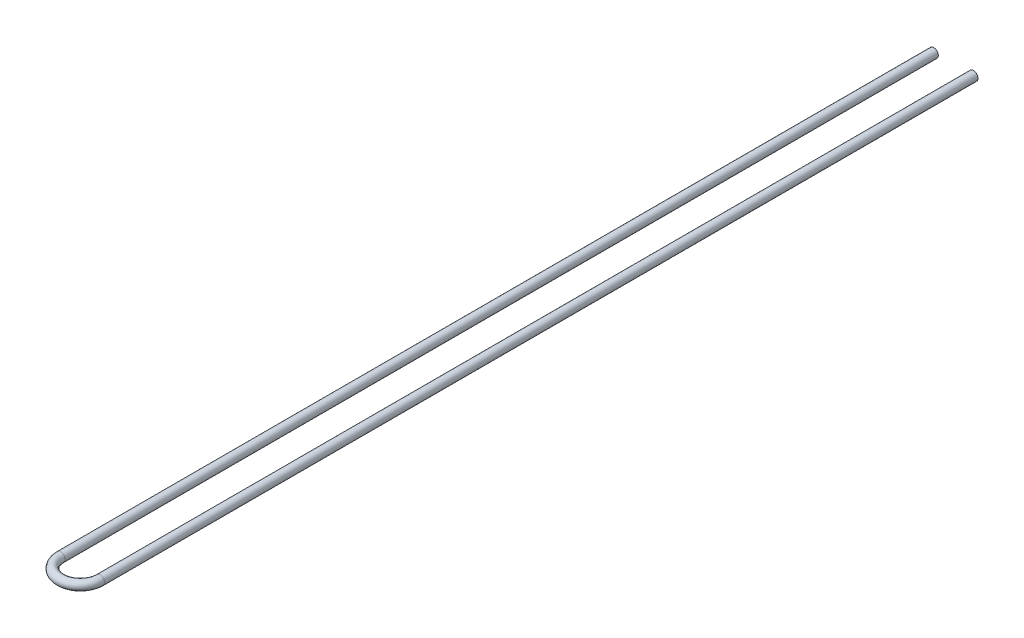
from build123d import *

# Parameters (mm, degrees)
SKETCH2_R   = 11.1
SKETCH2_R_2 = 9.95


with BuildPart() as part:
    # Sweep1: sweep along a path in Sketch1
    with BuildLine(Plane(origin=(0, 0, 0), x_dir=(1, 0, 0), z_dir=(0, 1, 0))) as sweep1_path:
        Line((57.23, -300), (57.23, -2440))
        ThreePointArc((57.23, -2440), (8.615, -2488.615), (-40, -2440))
        Line((-40, -2440), (-40, -300))
    # Sketch2 → Sweep1 (sweep)
    with BuildSketch(Plane(origin=(57.23, 0, 300), x_dir=(-1, 0, 0), z_dir=(0, 0, -1))):
        Circle(SKETCH2_R)
        Circle(SKETCH2_R_2, mode=Mode.SUBTRACT)
    sweep(path=sweep1_path.line)


solid = part.part
